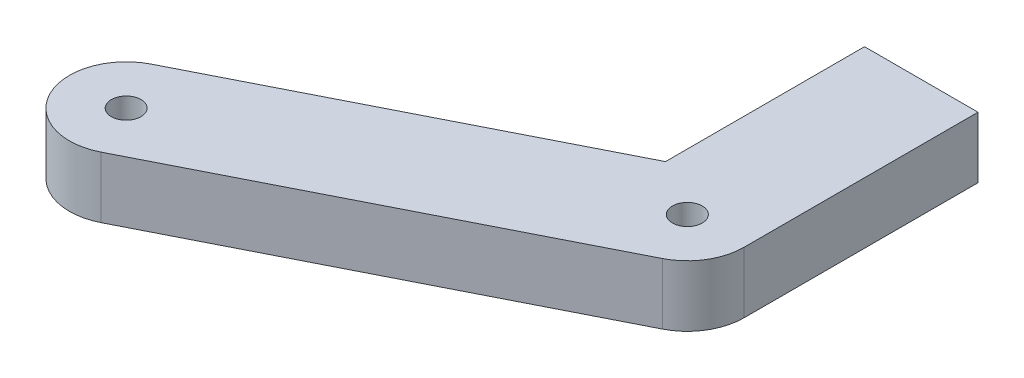
from build123d import *

# Parameters (mm, degrees)
SKETCH2_R           = 1.7
BOSS_EXTRUDE1_DEPTH = 7


with BuildPart() as part:
    # Sketch2 → Boss-Extrude1 (new body)
    with BuildSketch(Plane(origin=(0, 0, 0), x_dir=(1, 0, 0), z_dir=(0, 1, 0))):
        with BuildLine():
            Line((21.476765834, 56.323790381), (-17.656175951, 36.537368528))
            ThreePointArc((-17.656175951, 36.537368528), (-20.523911064, 27.803749844), (-11.79029238, 24.93601473))
            Line((-11.79029238, 24.93601473), (30.909707619, 46.52601473))
            ThreePointArc((30.909707619, 46.52601473), (33.5136477, 48.921851075), (34.476765834, 52.326691629))
            Line((34.476765834, 52.326691629), (34.476765834, 79.124442117))
            Line((34.476765834, 79.124442117), (21.476765834, 79.124442117))
            Line((21.476765834, 79.124442117), (21.476765834, 56.323790381))
        make_face()
        with Locations(Location((-14.723234165, 30.736691629, 0), (0, 0, 270))):
            Circle(SKETCH2_R, mode=Mode.SUBTRACT)
        with Locations(Location((27.976765834, 52.326691629, 0), (0, 0, 270))):
            Circle(SKETCH2_R, mode=Mode.SUBTRACT)
    extrude(amount=BOSS_EXTRUDE1_DEPTH)


solid = part.part
